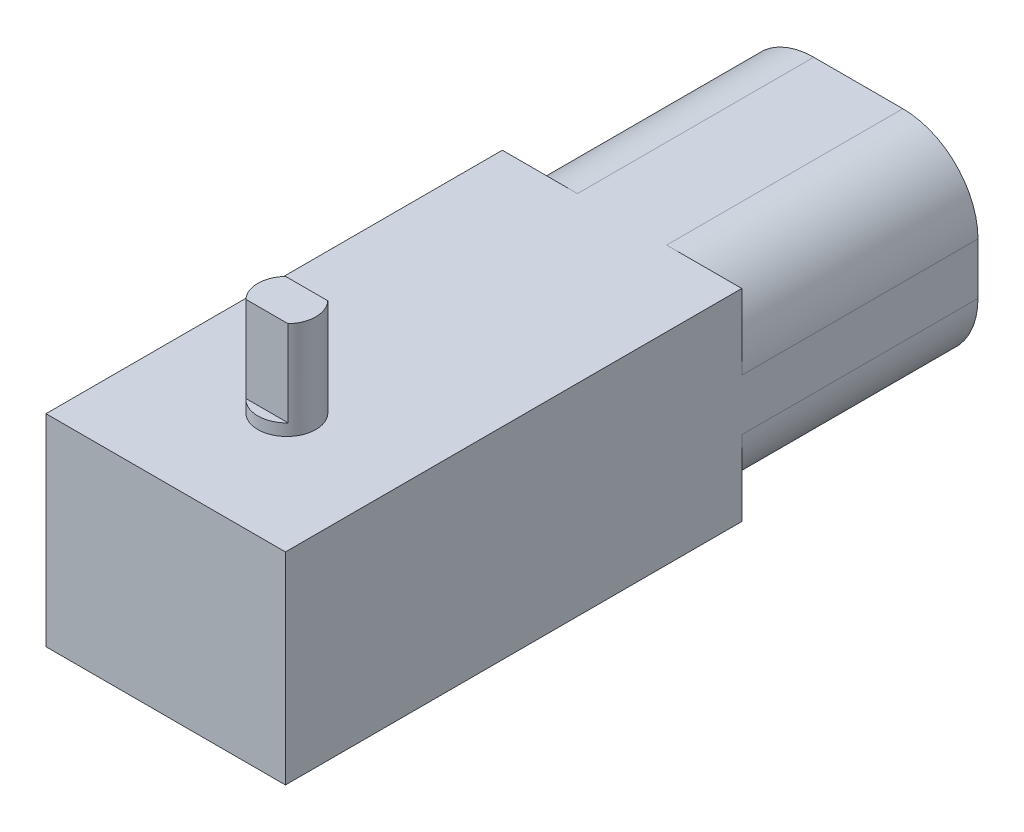
from build123d import *

# Parameters (mm, degrees)
SKETCH_1_W          = 22.3
SKETCH_1_H          = 64.5
EXTRUDE_1_DEPTH     = 18.8
SKETCH_2_R          = 2.7
EXTRUDE_2_DEPTH     = 9.1
SKETCH_3_W          = 7.709030296
SKETCH_3_H          = 1.42648476
SKETCH_3_H_2        = 1.599270141
CUT_EXTRUDE_1_DEPTH = 8
CUT_EXTRUDE_2_DEPTH = 22


with BuildPart() as part:
    # 草图1 → 凸台-拉伸1 (new body)
    with BuildSketch(Plane(origin=(0, 0, 0), x_dir=(1, 0, 0), z_dir=(0, 1, 0))):
        Rectangle(SKETCH_1_W, SKETCH_1_H)
    extrude(amount=EXTRUDE_1_DEPTH)

    # 草图2 → 凸台-拉伸2 (add)
    with BuildSketch(Plane(origin=(0, 18.8, 0), x_dir=(1, 0, 0), z_dir=(0, 1, 0))):
        with Locations(Location((0, -20.97, 0), (0, 0, 270))):
            Circle(SKETCH_2_R)
    extrude(amount=EXTRUDE_2_DEPTH)

    # 草图3 → 切除-拉伸1 (cut)
    with BuildSketch(Plane(origin=(0, 27.9, 0), x_dir=(1, 0, 0), z_dir=(0, 1, 0))):
        with Locations((0, -18.40675762)):
            Rectangle(SKETCH_3_W, SKETCH_3_H)
        with Locations((0, -23.619635071)):
            Rectangle(SKETCH_3_W, SKETCH_3_H_2)
    extrude(amount=-CUT_EXTRUDE_1_DEPTH, mode=Mode.SUBTRACT)

    # 草图4 → 切除-拉伸2 (cut)
    with BuildSketch(Plane(origin=(0, 0, -32.25), x_dir=(-1, 0, 0), z_dir=(0, 0, -1))):
        with BuildLine():
            ThreePointArc((11.15, 7), (9.099747468, 2.050252532), (4.15, 0))
            Line((4.15, 0), (11.15, 0))
            Line((11.15, 0), (11.15, 7))
        make_face()
        with BuildLine():
            ThreePointArc((4.15, 18.8), (9.099747468, 16.749747468), (11.15, 11.8))
            Line((11.15, 11.8), (11.15, 18.8))
            Line((11.15, 18.8), (4.15, 18.8))
        make_face()
        with BuildLine():
            Line((-11.15, 0), (-4.15, 0))
            ThreePointArc((-4.15, 0), (-9.099747468, 2.050252532), (-11.15, 7))
            Line((-11.15, 7), (-11.15, 0))
        make_face()
        with BuildLine():
            Line((-11.15, 18.8), (-11.15, 11.8))
            ThreePointArc((-11.15, 11.8), (-9.099747468, 16.749747468), (-4.15, 18.8))
            Line((-4.15, 18.8), (-11.15, 18.8))
        make_face()
    extrude(amount=-CUT_EXTRUDE_2_DEPTH, mode=Mode.SUBTRACT)


solid = part.part
